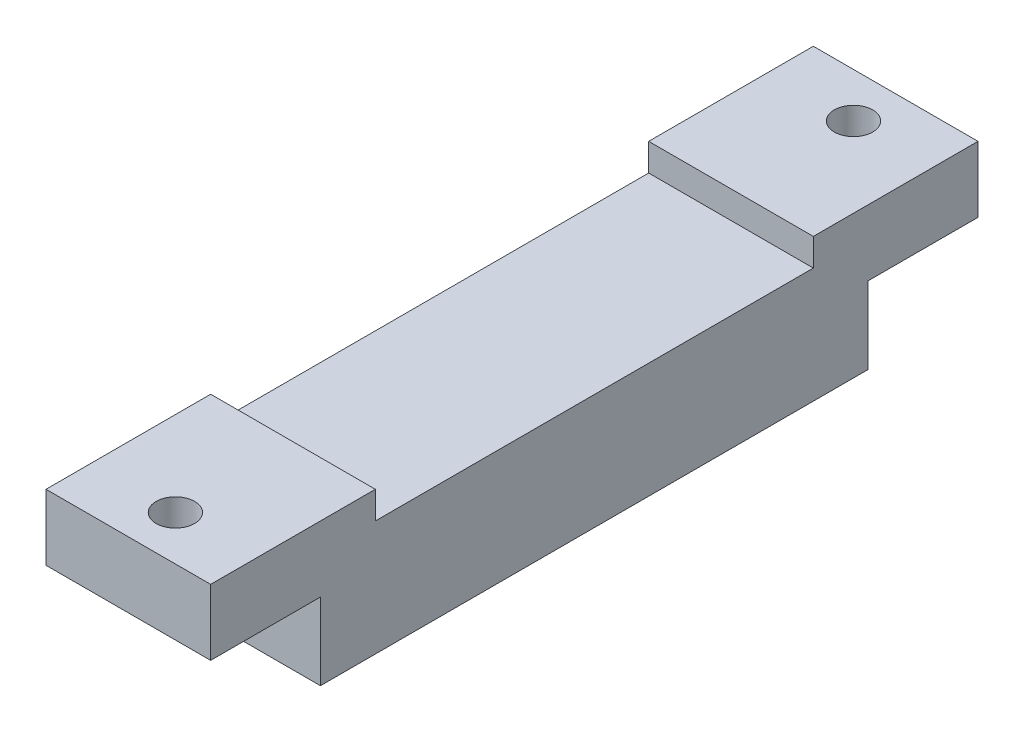
from build123d import *

# Parameters (mm, degrees)
SKETCH1_W           = 15
SKETCH1_H           = 49.9
BOSS_EXTRUDE1_DEPTH = 2
SKETCH2_W           = 45
SKETCH2_H           = 5
BOSS_EXTRUDE2_DEPTH = 5
SKETCH4_W           = 15
SKETCH4_H           = 49.9
BOSS_EXTRUDE3_DEPTH = 13
SKETCH5_W           = 15
SKETCH5_H           = 6
BOSS_EXTRUDE4_DEPTH = 10
SKETCH6_R           = 1.75
CUT_EXTRUDE2_DEPTH  = 48.859194519
SKETCH7_W           = 15
SKETCH7_H           = 39.9
CUT_EXTRUDE3_DEPTH  = 2.5
SKETCH8_W           = 50.368588126
SKETCH8_H           = 13
CUT_EXTRUDE4_DEPTH  = 48.859194519


with BuildPart() as part:
    # Sketch1 → Boss-Extrude1 (new body)
    with BuildSketch(Plane(origin=(0, 0, 0), x_dir=(1, 0, 0), z_dir=(0, 1, 0))):
        with Locations((7.5, 0)):
            Rectangle(SKETCH1_W, SKETCH1_H)
    extrude(amount=BOSS_EXTRUDE1_DEPTH)

    # Sketch2 → Boss-Extrude2 (add)
    with BuildSketch(Plane(origin=(0, 2, 0), x_dir=(1, 0, 0), z_dir=(0, 1, 0))):
        with Locations((-7.5, -22.45)):
            Rectangle(SKETCH2_W, SKETCH2_H)
        with Locations((-7.5, 22.45)):
            Rectangle(SKETCH2_W, SKETCH2_H)
    extrude(amount=BOSS_EXTRUDE2_DEPTH)

    # Sketch4 → Boss-Extrude3 (add)
    with BuildSketch(Plane(origin=(0, 0, 0), x_dir=(1, 0, 0), z_dir=(0, 1, 0))):
        with Locations((7.5, 0)):
            Rectangle(SKETCH4_W, SKETCH4_H)
    extrude(amount=BOSS_EXTRUDE3_DEPTH)

    # Sketch5 → Boss-Extrude4 (add)
    with BuildSketch(Plane(origin=(0, 0, -24.95), x_dir=(-1, 0, 0), z_dir=(0, 0, -1))):
        with Locations((-7.5, 10)):
            Rectangle(SKETCH5_W, SKETCH5_H)
    boss_extrude4 = extrude(amount=BOSS_EXTRUDE4_DEPTH)

    # Sketch6 → Cut-Extrude2 (cut, through all)
    with BuildSketch(Plane(origin=(0, 13, 0), x_dir=(1, 0, 0), z_dir=(0, 1, 0))):
        with Locations((7.722564817, 30.885688998)):
            Circle(SKETCH6_R)
    cut_extrude2 = extrude(amount=-CUT_EXTRUDE2_DEPTH, mode=Mode.SUBTRACT)

    # Mirror1: Boss-Extrude4, Cut-Extrude2 across plane
    add(boss_extrude4.mirror(Plane.XY))
    add(cut_extrude2.mirror(Plane.XY), mode=Mode.SUBTRACT)

    # Sketch7 → Cut-Extrude3 (cut)
    with BuildSketch(Plane(origin=(0, 13, 0), x_dir=(1, 0, 0), z_dir=(0, 1, 0))):
        with Locations((7.5, 0)):
            Rectangle(SKETCH7_W, SKETCH7_H)
    extrude(amount=-CUT_EXTRUDE3_DEPTH, mode=Mode.SUBTRACT)

    # Sketch8 → Cut-Extrude4 (cut, through all)
    with BuildSketch(Plane.ZY):
        with Locations((0.234294063, 6.5)):
            Rectangle(SKETCH8_W, SKETCH8_H)
    extrude(amount=CUT_EXTRUDE4_DEPTH, mode=Mode.SUBTRACT)


solid = part.part
